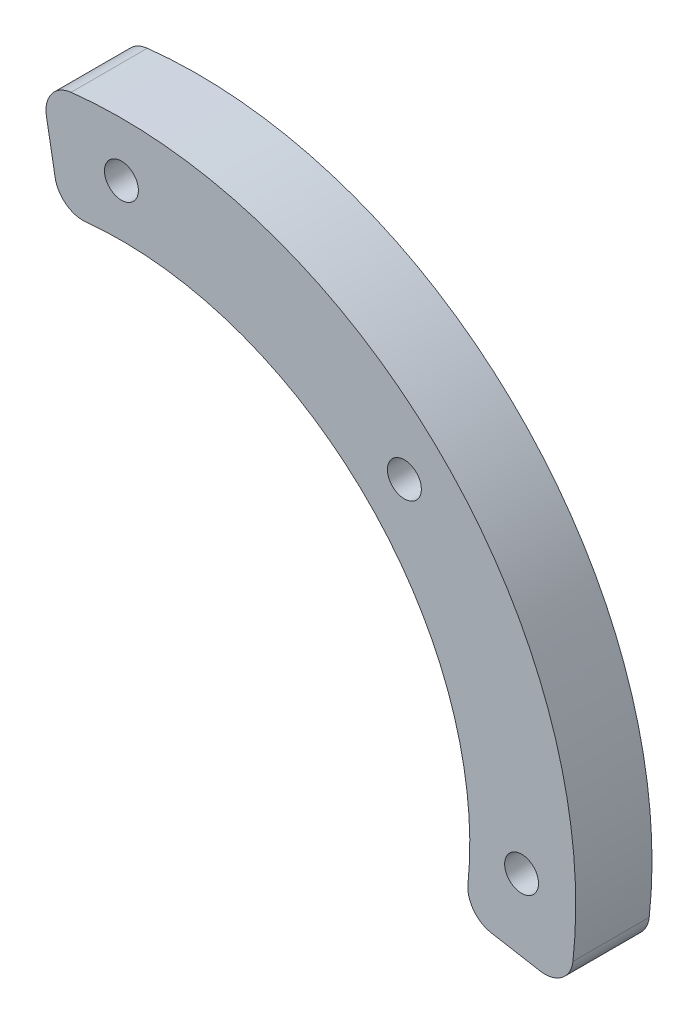
from build123d import *

# Parameters (mm, degrees)
SKETCH_1_R      = 1.8
EXTRUDE_1_DEPTH = 8.1


with BuildPart() as part:
    # 草图1 → 凸台-拉伸1 (new body)
    with BuildSketch(Plane.XY):
        with BuildLine():
            Line((-28.085321485, 24.455311821), (-27.156538847, 19.274809777))
            ThreePointArc((-27.156538847, 19.274809777), (-26.008495854, 17.407885349), (-23.897169242, 16.819914712))
            ThreePointArc((-23.897169242, 16.819914712), (6.047612353, 6.174156813), (16.688201762, -23.772461744))
            ThreePointArc((16.688201762, -23.772461744), (17.279148071, -25.888317514), (19.153455893, -27.034194196))
            Line((19.153455893, -27.034194196), (24.335957665, -27.944492213))
            ThreePointArc((24.335957665, -27.944492213), (26.653907402, -27.390513858), (27.836563196, -25.321429936))
            ThreePointArc((27.836563196, -25.321429936), (13.995899045, 14.135772324), (-25.464877169, 27.96624357))
            ThreePointArc((-25.464877169, 27.96624357), (-27.536589514, 26.779128998), (-28.085321485, 24.455311821))
        make_face()
        with Locations((22.382403744, -19.986536191)):
            Circle(SKETCH_1_R, mode=Mode.SUBTRACT)
        with Locations((9.934441945, 10.06550201)):
            Circle(SKETCH_1_R, mode=Mode.SUBTRACT)
        with Locations((-20.117596256, 22.513463809)):
            Circle(SKETCH_1_R, mode=Mode.SUBTRACT)
    extrude(amount=EXTRUDE_1_DEPTH)


solid = part.part
